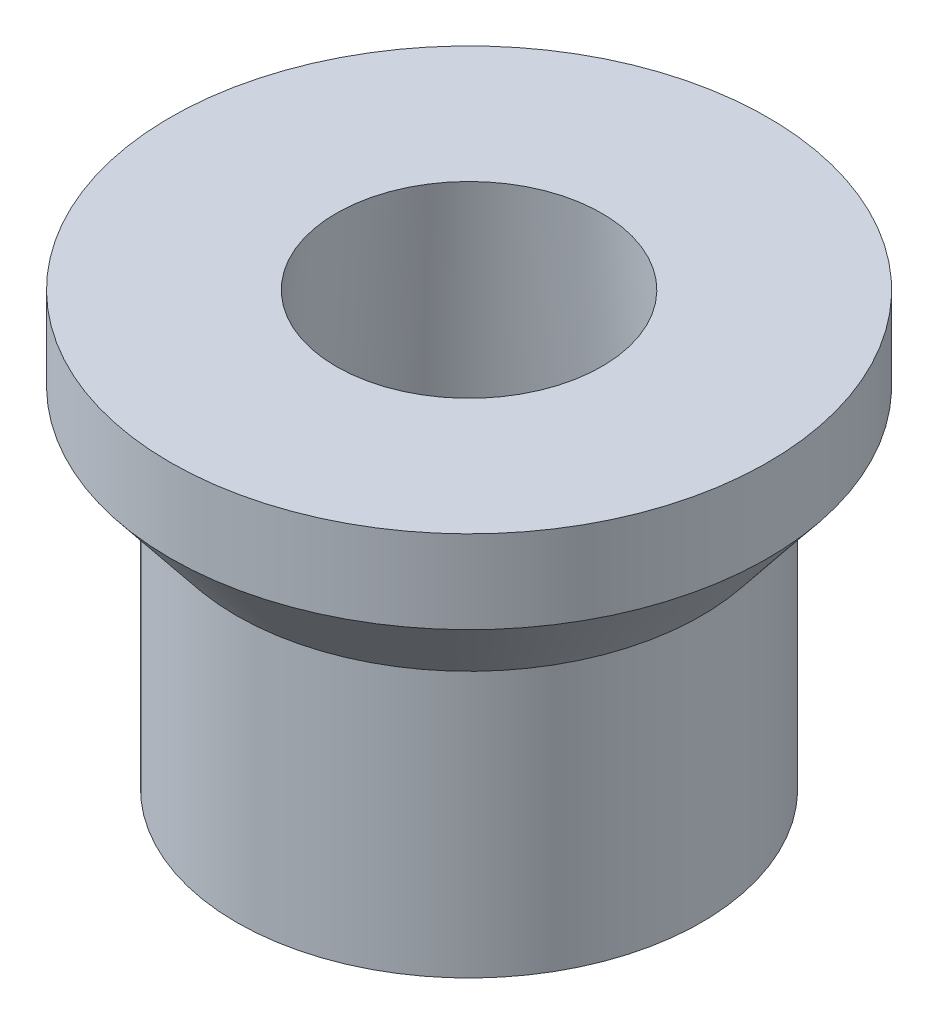
from build123d import *


with BuildPart() as part:
    # Sketch1 → Revolve-Thin7 (revolve)
    with BuildSketch(Plane.XY, mode=Mode.PRIVATE) as revolve_thin7_sk:
        Polygon((5, 0), (7, 0), (7, 8), (9, 10.5), (9, 13), (4, 13), align=None)
        Polygon((5.000092603, 0.0001), (6.9999, 0.0001), (6.9999, 8.000035078), (8.9999, 10.500035078), (8.9999, 12.9999), (4.000107988, 12.9999), align=None, mode=Mode.SUBTRACT)
    revolve(revolve_thin7_sk.sketch.rotate(Axis((0, 0, 0), (0, 1, 0)), 270), axis=Axis((0, 0, 0), (0, 1, 0)))


solid = part.part
